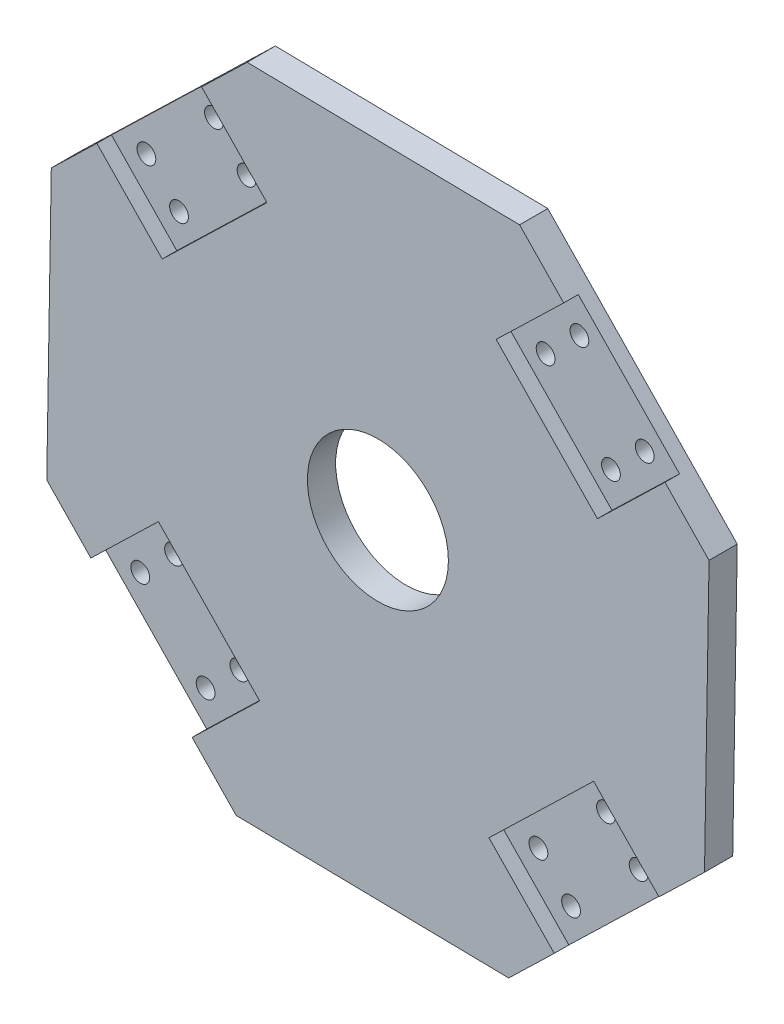
from build123d import *

# Parameters (mm, degrees)
RESSALTO_EXTRUS_O1_DEPTH = 6
CORTE_EXTRUS_O1_DEPTH    = 3.1
ESBO_O4_R                = 15
CORTE_EXTRUS_O2_DEPTH    = 100.844211363
ESBO_O6_R                = 2
CORTE_EXTRUS_O3_DEPTH    = 3.1


with BuildPart() as part:
    # Esboço2 → Ressalto-extrusão1 (new body)
    with BuildSketch(Plane.XY):
        Polygon((70.472925804, 27.825776133), (30.15608873, 69.507678721), (-27.825776133, 70.472925804), (-69.507678721, 30.15608873), (-70.472925804, -27.825776133), (-30.15608873, -69.507678721), (27.825776133, -70.472925804), (69.507678721, -30.15608873), align=None)
    extrude(amount=RESSALTO_EXTRUS_O1_DEPTH)

    # Esboço3 → Corte-extrusão1 (cut)
    with BuildSketch(Plane.XY.offset(6)):
        Polygon((-61.0871998, -37.529288249), (-39.534791939, -59.811427182), (-25.159218434, -45.906647917), (-46.711626295, -23.624508984), align=None)
        Polygon((46.71864909, 23.617248408), (25.166241229, 45.899387341), (39.541814734, 59.804166606), (61.094222595, 37.522027673), align=None)
        Polygon((-59.804166606, 39.541814734), (-37.522027673, 61.094222595), (-23.617248408, 46.71864909), (-45.899387341, 25.166241229), align=None)
        Polygon((23.631531779, -46.718886871), (45.913670712, -25.16647901), (59.818449977, -39.542052515), (37.536311044, -61.094460376), align=None)
    extrude(amount=-CORTE_EXTRUS_O1_DEPTH, mode=Mode.SUBTRACT)

    # Esboço4 → Corte-extrusão2 (cut, through all)
    with BuildSketch(Plane.XY.offset(6)):
        Circle(ESBO_O4_R)
    extrude(amount=-CORTE_EXTRUS_O2_DEPTH, mode=Mode.SUBTRACT)

    # Esboço6 → Corte-extrusão3 (cut)
    with BuildSketch(Plane.XY.offset(2.9)):
        with Locations((-46.481705373, -31.053986514)):
            Circle(ESBO_O6_R)
        with Locations((-53.669492126, -38.006376147)):
            Circle(ESBO_O6_R)
        with Locations((-39.764712861, -52.381949652)):
            Circle(ESBO_O6_R)
        with Locations((-32.576926108, -45.429560019)):
            Circle(ESBO_O6_R)
        with Locations((39.779293109, 52.368949317)):
            Circle(ESBO_O6_R)
        with Locations((32.590503175, 45.417596982)):
            Circle(ESBO_O6_R)
        with Locations((53.681997779, 37.991369449)):
            Circle(ESBO_O6_R)
        with Locations((46.493207845, 31.040017114)):
            Circle(ESBO_O6_R)
        with Locations((38.006376147, -53.669492126)):
            Circle(ESBO_O6_R)
        with Locations((31.061009309, -46.488965949)):
            Circle(ESBO_O6_R)
        with Locations((52.381949652, -39.764712861)):
            Circle(ESBO_O6_R)
        with Locations((45.436582814, -32.584186684)):
            Circle(ESBO_O6_R)
        with Locations((-37.991369449, 53.681997779)):
            Circle(ESBO_O6_R)
        with Locations((-31.047038861, 46.500469435)):
            Circle(ESBO_O6_R)
        with Locations((-45.424618729, 32.597764765)):
            Circle(ESBO_O6_R)
        with Locations((-52.368949317, 39.779293109)):
            Circle(ESBO_O6_R)
    extrude(amount=-CORTE_EXTRUS_O3_DEPTH, mode=Mode.SUBTRACT)


solid = part.part
